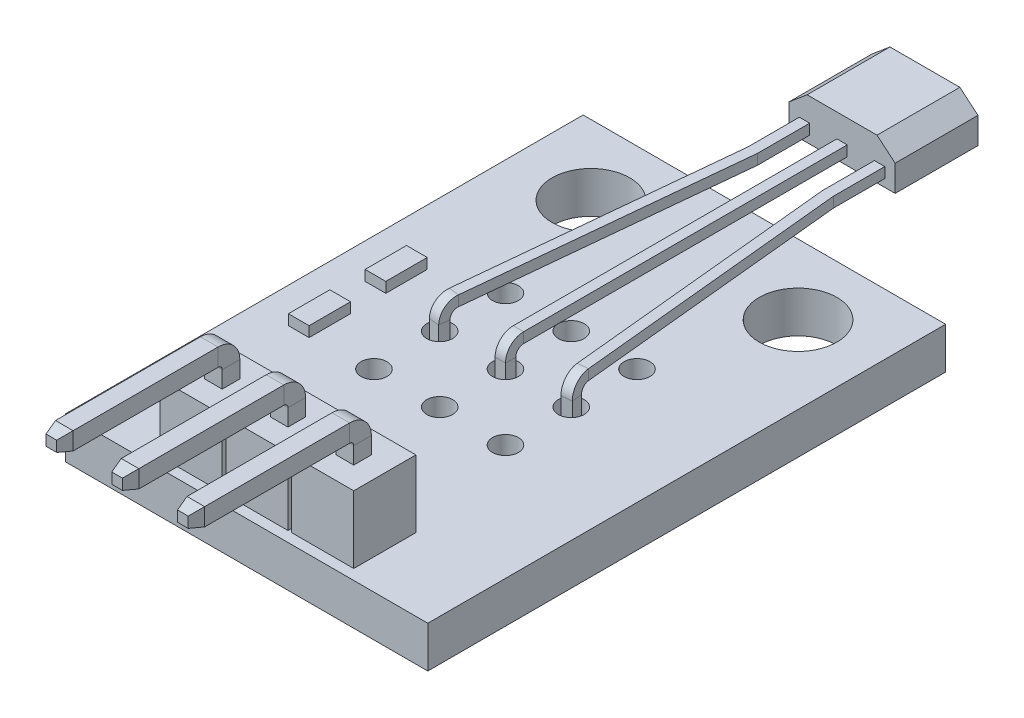
from build123d import *
from OCP.BRepFilletAPI import BRepFilletAPI_MakeChamfer

# Parameters (mm, degrees)
SKETCH1_W           = 14
SKETCH1_H           = 20
BOSS_EXTRUDE1_DEPTH = 1.6
SKETCH2_W           = 2.4
SKETCH2_H           = 2.4
BOSS_EXTRUDE2_DEPTH = 2.6
SKETCH4_W           = 0.68
SKETCH4_H           = 0.68
SKETCH8_R           = 0.5
CUT_EXTRUDE2_DEPTH  = 18.050750717
CHAMFER1_SIZE       = 0.5
CHAMFER1_SIZE2      = 0.133974596
SKETCH5_R           = 1.5
CUT_EXTRUDE1_DEPTH  = 18.050750717
SKETCH6_W           = 4.1
SKETCH6_H           = 1.6
BOSS_EXTRUDE3_DEPTH = 3.2
CHAMFER2_SIZE       = 0.7
CHAMFER2_SIZE2      = 0.587369742
BOSS_EXTRUDE4_START = -0.3
SKETCH7_W           = 0.4
SKETCH7_H           = 11.97256542
BOSS_EXTRUDE4_DEPTH = 0.4
SKETCH10_W          = 0.4
SKETCH10_H          = 0.4
SKETCH12_W          = 0.4
SKETCH12_H          = 0.4
SKETCH13_W          = 0.8
SKETCH13_H          = 1.6
BOSS_EXTRUDE5_DEPTH = 0.4


with BuildPart() as part:
    # Sketch1 → Boss-Extrude1 (new body)
    with BuildSketch(Plane(origin=(0, 0, 0), x_dir=(1, 0, 0), z_dir=(0, 1, 0))):
        Rectangle(SKETCH1_W, SKETCH1_H)
    extrude(amount=BOSS_EXTRUDE1_DEPTH)

    # Sketch2 → Boss-Extrude2 (add)
    with BuildSketch(Plane(origin=(0, 1.6, 0), x_dir=(1, 0, 0), z_dir=(0, 1, 0))):
        with Locations((0, -8.4)):
            Rectangle(SKETCH2_W, SKETCH2_H)
        with Locations((-2.54, -8.4)):
            Rectangle(SKETCH2_W, SKETCH2_H)
        with Locations((2.54, -8.4)):
            Rectangle(SKETCH2_W, SKETCH2_H)
    extrude(amount=BOSS_EXTRUDE2_DEPTH)

    # Sweep1: sweep along a path in Sketch3
    with BuildLine(Plane(origin=(0, 0, 0), x_dir=(0, 0, -1), z_dir=(1, 0, 0))) as sweep1_path:
        Line((-15, 5.35), (-8.9, 5.35))
        ThreePointArc((-8.9, 5.35), (-8.546446609, 5.203553391), (-8.4, 4.85))
        Line((-8.4, 4.85), (-8.4, -1))
    # Sketch4 → Sweep1 (sweep)
    with BuildSketch(Plane(origin=(0, 0, 15), x_dir=(-1, 0, 0), z_dir=(0, 0, -1))):
        with Locations((0, 5.35)):
            Rectangle(SKETCH4_W, SKETCH4_H)
        with Locations((2.54, 5.35)):
            Rectangle(SKETCH4_W, SKETCH4_H)
        with Locations((-2.54, 5.35)):
            Rectangle(SKETCH4_W, SKETCH4_H)
    sweep(path=sweep1_path.line)

    # Sketch8 → Cut-Extrude2 (cut, through all)
    with BuildSketch(Plane(origin=(0, 1.6, 0), x_dir=(1, 0, 0), z_dir=(0, 1, 0))):
        with Locations(Location((-2.54, 2.54, 0), (0, 0, 270))):
            Circle(SKETCH8_R)
        with Locations(Location((0, 2.54, 0), (0, 0, 270))):
            Circle(SKETCH8_R)
        with Locations(Location((2.54, 2.54, 0), (0, 0, 270))):
            Circle(SKETCH8_R)
        with Locations(Location((0, 0, 0), (0, 0, 270))):
            Circle(SKETCH8_R)
        with Locations(Location((2.54, 0, 0), (0, 0, 270))):
            Circle(SKETCH8_R)
        with Locations(Location((0, -2.54, 0), (0, 0, 270))):
            Circle(SKETCH8_R)
        with Locations(Location((2.54, -2.54, 0), (0, 0, 270))):
            Circle(SKETCH8_R)
        with Locations(Location((-2.54, 0, 0), (0, 0, 270))):
            Circle(SKETCH8_R)
        with Locations(Location((-2.54, -2.54, 0), (0, 0, 270))):
            Circle(SKETCH8_R)
    extrude(amount=-CUT_EXTRUDE2_DEPTH, mode=Mode.SUBTRACT)

    # Chamfer1: one chamfer whose edges measure the first distance from different faces: ONE call of the kernel's chamfer builder (chamfer() names one face for all edges)
    chamfer1_edges_1 = [part.edges().sort_by_distance(p)[0] for p in [
        (2.2, -1, 8.4),
    ]]
    chamfer1_side_1 = [part.faces().sort_by_distance(p)[0] for p in [
        (2.2, -0.5, 8.4),
    ]]
    chamfer1_edges_2 = [part.edges().sort_by_distance(p)[0] for p in [
        (2.54, -1, 8.06),
    ]]
    chamfer1_side_2 = [part.faces().sort_by_distance(p)[0] for p in [
        (2.54, -0.5, 8.06),
    ]]
    chamfer1_edges_3 = [part.edges().sort_by_distance(p)[0] for p in [
        (2.88, -1, 8.4),
    ]]
    chamfer1_side_3 = [part.faces().sort_by_distance(p)[0] for p in [
        (2.88, -0.5, 8.4),
    ]]
    chamfer1_edges_4 = [part.edges().sort_by_distance(p)[0] for p in [
        (2.54, -1, 8.74),
    ]]
    chamfer1_side_4 = [part.faces().sort_by_distance(p)[0] for p in [
        (2.54, -0.5, 8.74),
    ]]
    chamfer1_edges_5 = [part.edges().sort_by_distance(p)[0] for p in [
        (2.88, 5.35, 15),
    ]]
    chamfer1_side_5 = [part.faces().sort_by_distance(p)[0] for p in [
        (2.88, 5.265012354, 11.287593366),
    ]]
    chamfer1_edges_6 = [part.edges().sort_by_distance(p)[0] for p in [
        (2.54, 5.01, 15),
    ]]
    chamfer1_side_6 = [part.faces().sort_by_distance(p)[0] for p in [
        (2.54, 5.01, 11.95),
    ]]
    chamfer1_edges_7 = [part.edges().sort_by_distance(p)[0] for p in [
        (2.2, 5.35, 15),
    ]]
    chamfer1_side_7 = [part.faces().sort_by_distance(p)[0] for p in [
        (2.2, 5.265012354, 11.287593366),
    ]]
    chamfer1_edges_8 = [part.edges().sort_by_distance(p)[0] for p in [
        (2.54, 5.69, 15),
    ]]
    chamfer1_side_8 = [part.faces().sort_by_distance(p)[0] for p in [
        (2.54, 5.69, 11.95),
    ]]
    chamfer1_edges_9 = [part.edges().sort_by_distance(p)[0] for p in [
        (-2.88, -1, 8.4),
    ]]
    chamfer1_side_9 = [part.faces().sort_by_distance(p)[0] for p in [
        (-2.88, -0.5, 8.4),
    ]]
    chamfer1_edges_10 = [part.edges().sort_by_distance(p)[0] for p in [
        (-2.54, -1, 8.06),
    ]]
    chamfer1_side_10 = [part.faces().sort_by_distance(p)[0] for p in [
        (-2.54, -0.5, 8.06),
    ]]
    chamfer1_edges_11 = [part.edges().sort_by_distance(p)[0] for p in [
        (-2.2, -1, 8.4),
    ]]
    chamfer1_side_11 = [part.faces().sort_by_distance(p)[0] for p in [
        (-2.2, -0.5, 8.4),
    ]]
    chamfer1_edges_12 = [part.edges().sort_by_distance(p)[0] for p in [
        (-2.54, -1, 8.74),
    ]]
    chamfer1_side_12 = [part.faces().sort_by_distance(p)[0] for p in [
        (-2.54, -0.5, 8.74),
    ]]
    chamfer1_edges_13 = [part.edges().sort_by_distance(p)[0] for p in [
        (-2.2, 5.35, 15),
    ]]
    chamfer1_side_13 = [part.faces().sort_by_distance(p)[0] for p in [
        (-2.2, 5.265012354, 11.287593366),
    ]]
    chamfer1_edges_14 = [part.edges().sort_by_distance(p)[0] for p in [
        (-2.54, 5.01, 15),
    ]]
    chamfer1_side_14 = [part.faces().sort_by_distance(p)[0] for p in [
        (-2.54, 5.01, 11.95),
    ]]
    chamfer1_edges_15 = [part.edges().sort_by_distance(p)[0] for p in [
        (-2.88, 5.35, 15),
    ]]
    chamfer1_side_15 = [part.faces().sort_by_distance(p)[0] for p in [
        (-2.88, 5.265012354, 11.287593366),
    ]]
    chamfer1_edges_16 = [part.edges().sort_by_distance(p)[0] for p in [
        (-2.54, 5.69, 15),
    ]]
    chamfer1_side_16 = [part.faces().sort_by_distance(p)[0] for p in [
        (-2.54, 5.69, 11.95),
    ]]
    chamfer1_edges_17 = [part.edges().sort_by_distance(p)[0] for p in [
        (-0.34, -1, 8.4),
    ]]
    chamfer1_side_17 = [part.faces().sort_by_distance(p)[0] for p in [
        (-0.34, -0.5, 8.4),
    ]]
    chamfer1_edges_18 = [part.edges().sort_by_distance(p)[0] for p in [
        (0, -1, 8.06),
    ]]
    chamfer1_side_18 = [part.faces().sort_by_distance(p)[0] for p in [
        (0, -0.5, 8.06),
    ]]
    chamfer1_edges_19 = [part.edges().sort_by_distance(p)[0] for p in [
        (0.34, -1, 8.4),
    ]]
    chamfer1_side_19 = [part.faces().sort_by_distance(p)[0] for p in [
        (0.34, -0.5, 8.4),
    ]]
    chamfer1_edges_20 = [part.edges().sort_by_distance(p)[0] for p in [
        (0, -1, 8.74),
    ]]
    chamfer1_side_20 = [part.faces().sort_by_distance(p)[0] for p in [
        (0, -0.5, 8.74),
    ]]
    chamfer1_edges_21 = [part.edges().sort_by_distance(p)[0] for p in [
        (0.34, 5.35, 15),
    ]]
    chamfer1_side_21 = [part.faces().sort_by_distance(p)[0] for p in [
        (0.34, 5.265012354, 11.287593366),
    ]]
    chamfer1_edges_22 = [part.edges().sort_by_distance(p)[0] for p in [
        (0, 5.01, 15),
    ]]
    chamfer1_side_22 = [part.faces().sort_by_distance(p)[0] for p in [
        (0, 5.01, 11.95),
    ]]
    chamfer1_edges_23 = [part.edges().sort_by_distance(p)[0] for p in [
        (-0.34, 5.35, 15),
    ]]
    chamfer1_side_23 = [part.faces().sort_by_distance(p)[0] for p in [
        (-0.34, 5.265012354, 11.287593366),
    ]]
    chamfer1_edges_24 = [part.edges().sort_by_distance(p)[0] for p in [
        (0, 5.69, 15),
    ]]
    chamfer1_side_24 = [part.faces().sort_by_distance(p)[0] for p in [
        (0, 5.69, 11.95),
    ]]
    chamfer1 = BRepFilletAPI_MakeChamfer(part.part.solid().wrapped)
    for e in chamfer1_edges_1:
        chamfer1.Add(CHAMFER1_SIZE, CHAMFER1_SIZE2, e.wrapped, chamfer1_side_1[0].wrapped)  # the first distance lies on this face
    for e in chamfer1_edges_2:
        chamfer1.Add(CHAMFER1_SIZE, CHAMFER1_SIZE2, e.wrapped, chamfer1_side_2[0].wrapped)  # the first distance lies on this face
    for e in chamfer1_edges_3:
        chamfer1.Add(CHAMFER1_SIZE, CHAMFER1_SIZE2, e.wrapped, chamfer1_side_3[0].wrapped)  # the first distance lies on this face
    for e in chamfer1_edges_4:
        chamfer1.Add(CHAMFER1_SIZE, CHAMFER1_SIZE2, e.wrapped, chamfer1_side_4[0].wrapped)  # the first distance lies on this face
    for e in chamfer1_edges_5:
        chamfer1.Add(CHAMFER1_SIZE, CHAMFER1_SIZE2, e.wrapped, chamfer1_side_5[0].wrapped)  # the first distance lies on this face
    for e in chamfer1_edges_6:
        chamfer1.Add(CHAMFER1_SIZE, CHAMFER1_SIZE2, e.wrapped, chamfer1_side_6[0].wrapped)  # the first distance lies on this face
    for e in chamfer1_edges_7:
        chamfer1.Add(CHAMFER1_SIZE, CHAMFER1_SIZE2, e.wrapped, chamfer1_side_7[0].wrapped)  # the first distance lies on this face
    for e in chamfer1_edges_8:
        chamfer1.Add(CHAMFER1_SIZE, CHAMFER1_SIZE2, e.wrapped, chamfer1_side_8[0].wrapped)  # the first distance lies on this face
    for e in chamfer1_edges_9:
        chamfer1.Add(CHAMFER1_SIZE, CHAMFER1_SIZE2, e.wrapped, chamfer1_side_9[0].wrapped)  # the first distance lies on this face
    for e in chamfer1_edges_10:
        chamfer1.Add(CHAMFER1_SIZE, CHAMFER1_SIZE2, e.wrapped, chamfer1_side_10[0].wrapped)  # the first distance lies on this face
    for e in chamfer1_edges_11:
        chamfer1.Add(CHAMFER1_SIZE, CHAMFER1_SIZE2, e.wrapped, chamfer1_side_11[0].wrapped)  # the first distance lies on this face
    for e in chamfer1_edges_12:
        chamfer1.Add(CHAMFER1_SIZE, CHAMFER1_SIZE2, e.wrapped, chamfer1_side_12[0].wrapped)  # the first distance lies on this face
    for e in chamfer1_edges_13:
        chamfer1.Add(CHAMFER1_SIZE, CHAMFER1_SIZE2, e.wrapped, chamfer1_side_13[0].wrapped)  # the first distance lies on this face
    for e in chamfer1_edges_14:
        chamfer1.Add(CHAMFER1_SIZE, CHAMFER1_SIZE2, e.wrapped, chamfer1_side_14[0].wrapped)  # the first distance lies on this face
    for e in chamfer1_edges_15:
        chamfer1.Add(CHAMFER1_SIZE, CHAMFER1_SIZE2, e.wrapped, chamfer1_side_15[0].wrapped)  # the first distance lies on this face
    for e in chamfer1_edges_16:
        chamfer1.Add(CHAMFER1_SIZE, CHAMFER1_SIZE2, e.wrapped, chamfer1_side_16[0].wrapped)  # the first distance lies on this face
    for e in chamfer1_edges_17:
        chamfer1.Add(CHAMFER1_SIZE, CHAMFER1_SIZE2, e.wrapped, chamfer1_side_17[0].wrapped)  # the first distance lies on this face
    for e in chamfer1_edges_18:
        chamfer1.Add(CHAMFER1_SIZE, CHAMFER1_SIZE2, e.wrapped, chamfer1_side_18[0].wrapped)  # the first distance lies on this face
    for e in chamfer1_edges_19:
        chamfer1.Add(CHAMFER1_SIZE, CHAMFER1_SIZE2, e.wrapped, chamfer1_side_19[0].wrapped)  # the first distance lies on this face
    for e in chamfer1_edges_20:
        chamfer1.Add(CHAMFER1_SIZE, CHAMFER1_SIZE2, e.wrapped, chamfer1_side_20[0].wrapped)  # the first distance lies on this face
    for e in chamfer1_edges_21:
        chamfer1.Add(CHAMFER1_SIZE, CHAMFER1_SIZE2, e.wrapped, chamfer1_side_21[0].wrapped)  # the first distance lies on this face
    for e in chamfer1_edges_22:
        chamfer1.Add(CHAMFER1_SIZE, CHAMFER1_SIZE2, e.wrapped, chamfer1_side_22[0].wrapped)  # the first distance lies on this face
    for e in chamfer1_edges_23:
        chamfer1.Add(CHAMFER1_SIZE, CHAMFER1_SIZE2, e.wrapped, chamfer1_side_23[0].wrapped)  # the first distance lies on this face
    for e in chamfer1_edges_24:
        chamfer1.Add(CHAMFER1_SIZE, CHAMFER1_SIZE2, e.wrapped, chamfer1_side_24[0].wrapped)  # the first distance lies on this face
    add(Compound.cast(chamfer1.Shape()), mode=Mode.REPLACE)

    # Sketch5 → Cut-Extrude1 (cut, through all)
    with BuildSketch(Plane(origin=(0, 1.6, 0), x_dir=(1, 0, 0), z_dir=(0, 1, 0))):
        with Locations(Location((-4, 7.3, 0), (0, 0, 270))):
            Circle(SKETCH5_R)
        with Locations(Location((4, 7.3, 0), (0, 0, 270))):
            Circle(SKETCH5_R)
    extrude(amount=-CUT_EXTRUDE1_DEPTH, mode=Mode.SUBTRACT)

    # Sketch13 → Boss-Extrude5 (add)
    with BuildSketch(Plane(origin=(0, 1.6, 0), x_dir=(1, 0, 0), z_dir=(0, 1, 0))):
        with Locations((-5.245052358, 1.022726005)):
            Rectangle(SKETCH13_W, SKETCH13_H)
        with Locations((-5.245052358, -1.940051544)):
            Rectangle(SKETCH13_W, SKETCH13_H)
    extrude(amount=BOSS_EXTRUDE5_DEPTH)


with BuildPart() as body_2:
    # Sketch6 → Boss-Extrude3 (new body)
    with BuildSketch(Plane(origin=(0, 0, -13), x_dir=(-1, 0, 0), z_dir=(0, 0, -1))):
        with Locations((0, 2.8)):
            Rectangle(SKETCH6_W, SKETCH6_H)
    extrude(amount=BOSS_EXTRUDE3_DEPTH)

    # Chamfer2
    chamfer2_edges = [body_2.edges().sort_by_distance(p)[0] for p in [
        (2.05, 3.6, -14.6),
        (-2.05, 3.6, -14.6),
    ]]
    chamfer2_side = [body_2.faces().sort_by_distance(p)[0] for p in [
        (0, 3.6, -14.6),
    ]]
    chamfer(chamfer2_edges, length=CHAMFER2_SIZE, length2=CHAMFER2_SIZE2, reference=chamfer2_side[0])

    # Sketch7 → Boss-Extrude4 (add)
    with BuildSketch(Plane.XZ.offset(-2).offset(BOSS_EXTRUDE4_START)):
        Polygon((1.65, -13), (1.65, -11.009884885), (2.637215845, -1.047156176), (2.239165302, -1.007712985), (1.25, -10.990115115), (1.25, -13), align=None)
        with Locations((0, -7.01371729)):
            Rectangle(SKETCH7_W, SKETCH7_H)
        Polygon((-1.25, -13), (-1.25, -10.990115115), (-2.239165302, -1.007712985), (-2.637215845, -1.047156176), (-1.65, -11.009884885), (-1.65, -13), align=None)
    extrude(amount=-BOSS_EXTRUDE4_DEPTH)

    # Sweep2: sweep along a path in Sketch9
    with BuildLine(Plane(origin=(0, 0, 0), x_dir=(0, 0, -1), z_dir=(1, 0, 0))) as sweep2_path:
        Line((0, -1), (0, 2))
        ThreePointArc((0, 2), (0.146446609, 2.353553391), (0.5, 2.5))
        Line((0.5, 2.5), (1.02743458, 2.5))
    # Sketch10 → Sweep2 (sweep)
    with BuildSketch(Plane.XY.offset(-1.02743458)):
        with Locations((0, 2.5)):
            Rectangle(SKETCH10_W, SKETCH10_H)
    sweep(path=sweep2_path.line)

    # Sweep3: sweep along a path in Sketch11
    with BuildLine(Plane(origin=(-2.714327498, 0, -0.268965179), x_dir=(-0.09860797541471335, 0, 0.9951263573961909), z_dir=(-0.9951263573961909, 0, -0.09860797541471335))) as sweep3_path:
        Line((-0.782002195, 2.5), (-0.249535742, 2.5))
        ThreePointArc((-0.249535742, 2.5), (0.104017648, 2.353553391), (0.250464258, 2))
        Line((0.250464258, 2), (0.250464258, -1))
    # Sketch12 → Sweep3 (sweep)
    with BuildSketch(Plane(origin=(0.077111653, 0, -0.778190996), x_dir=(0.9951263573961909, 0, 0.09860797541471333), z_dir=(-0.09860797541471333, 0, 0.9951263573961909))):
        with Locations((-2.527620948, 2.5)):
            Rectangle(SKETCH12_W, SKETCH12_H)
    sweep3 = sweep(path=sweep3_path.line)

    # Mirror1: Sweep3 across plane
    add(sweep3.mirror(Plane(origin=(0, 0, 0), x_dir=(0, 0, 1), z_dir=(1, 0, 0))))


solid = Compound([part.part, body_2.part])
